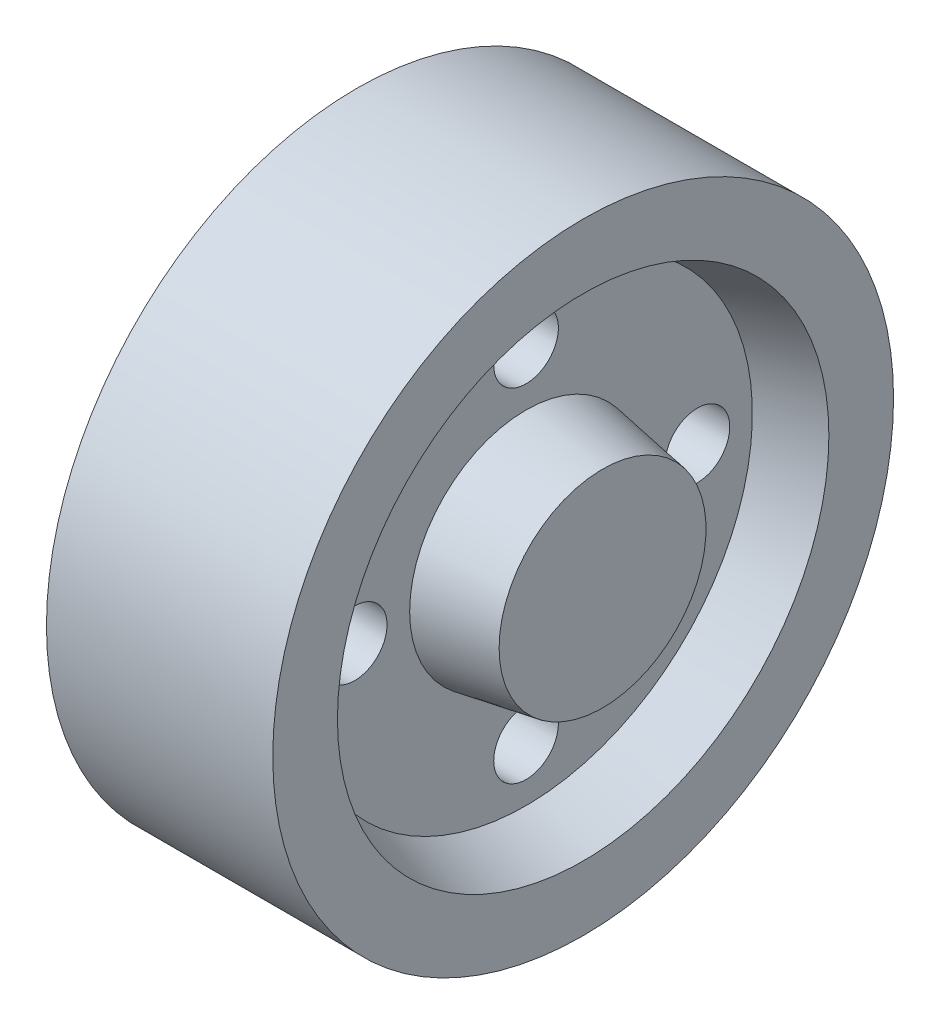
from build123d import *

# Parameters (mm, degrees)
SKETCH2_R          = 5
SKETCH2_R_2        = 10
CUT_EXTRUDE1_DEPTH = 26


with BuildPart() as part:
    # Sketch1 → Revolve1 (revolve)
    with BuildSketch(Plane.XY, mode=Mode.PRIVATE) as revolve1_sk:
        Polygon((-20.5, 0), (-20.5, 16), (-8.667840434, 18), (-8.667840434, 35), (-17.5, 38), (-17.5, 48), (17.5, 48), (17.5, 38), (8.667840434, 35), (8.667840434, 18), (20.5, 16), (20.5, 0), align=None)
    revolve(revolve1_sk.sketch.rotate(Axis((-20.5, 0, 0), (1, 0, 0)), 90), axis=Axis((-20.5, 0, 0), (1, 0, 0)))

    # Sketch2 → Cut-Extrude1 (cut)
    with BuildSketch(Plane.ZY.offset(8.667840434)):
        with Locations((0, 26.5)):
            Circle(SKETCH2_R)
        with Locations((26.5, 0)):
            Circle(SKETCH2_R)
        with Locations((0, -26.5)):
            Circle(SKETCH2_R)
        with Locations((-26.5, 0)):
            Circle(SKETCH2_R)
        Circle(SKETCH2_R_2)
    extrude(amount=-CUT_EXTRUDE1_DEPTH, mode=Mode.SUBTRACT)


solid = part.part
